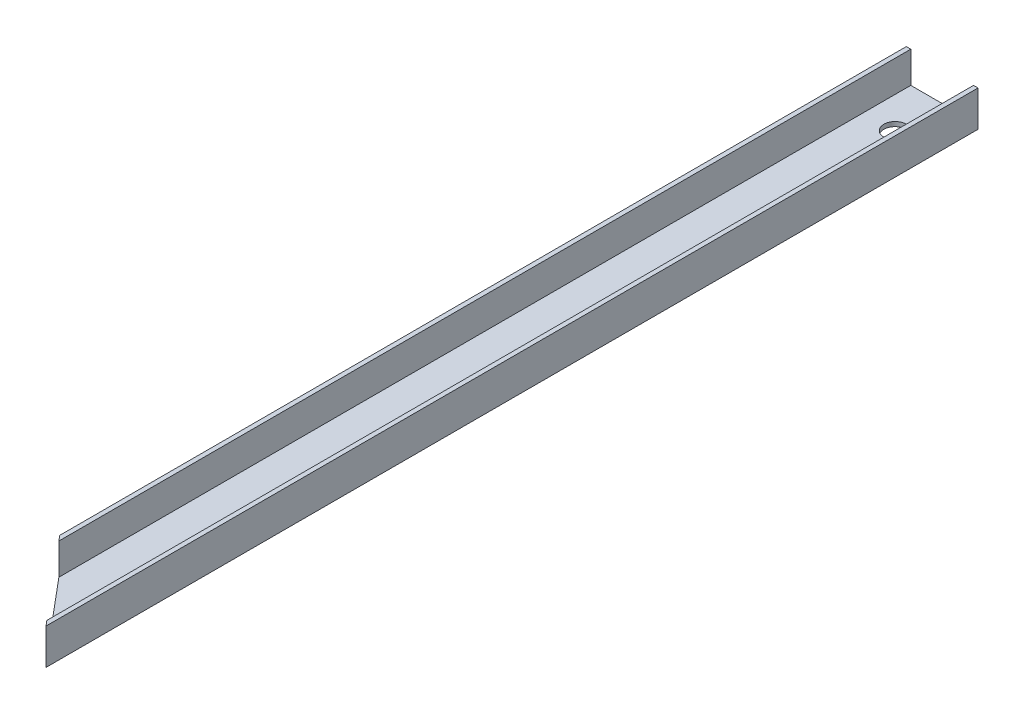
from build123d import *

# Parameters (mm, degrees)
BOSS_EXTRUDE1_DEPTH = 660.4
CUT_EXTRUDE1_DEPTH  = 662.376201568
CUT_EXTRUDE2_REACH  = 663.376
SKETCH3_R           = 7.9375


with BuildPart() as part:
    # Sketch1 → Boss-Extrude1 (new body)
    with BuildSketch(Plane.XY):
        Polygon((-22.225, -9.525), (-22.225, 12.7), (-25.4, 12.7), (-25.4, -12.7), (25.4, -12.7), (25.4, 12.7), (22.225, 12.7), (22.225, -9.525), align=None)
    extrude(amount=BOSS_EXTRUDE1_DEPTH)

    # Sketch2 → Cut-Extrude1 (cut, through all)
    with BuildSketch(Plane.XZ.offset(12.7)):
        Polygon((25.4, 660.4), (-25.4, 599.858917496), (-25.4, 660.4), align=None)
    extrude(amount=-CUT_EXTRUDE1_DEPTH, mode=Mode.SUBTRACT)

    # Sketch3 → Cut-Extrude2 (cut, up to next)
    with BuildSketch(Plane.XZ.offset(12.7), mode=Mode.PRIVATE) as cut_extrude2_sk1:
        with Locations((0, 33.3375)):
            Circle(SKETCH3_R)
    cut_extrude2_tool1 = extrude(cut_extrude2_sk1.sketch, amount=-CUT_EXTRUDE2_REACH, mode=Mode.PRIVATE) & part.part
    add(cut_extrude2_tool1.solids().sort_by_distance((0, -12.7, 33.3375))[0], mode=Mode.SUBTRACT)


solid = part.part
